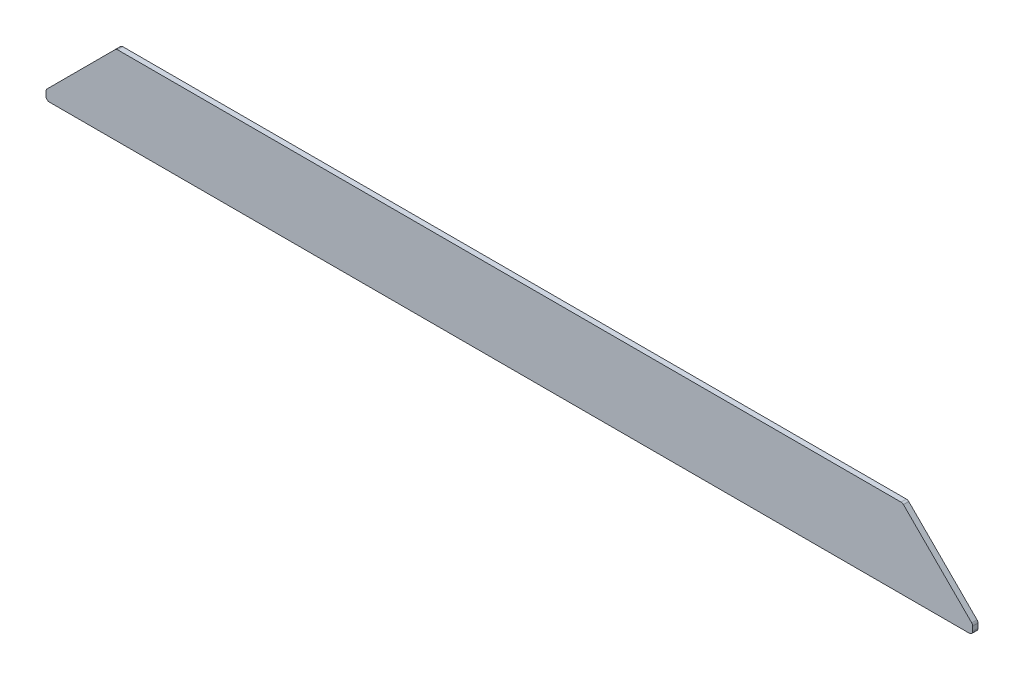
from build123d import *

# Parameters (mm, degrees)
BOSS_EXTRUDE1_DEPTH = 1.6
FILLET1_R           = 1
BOSS_EXTRUDE2_DEPTH = 1.6


with BuildPart() as part:
    # Sketch1 → Boss-Extrude1 (new body)
    with BuildSketch(Plane.XY):
        with BuildLine():
            Line((21.213203436, 24), (0, 2.786796564))
            Line((0, 2.786796564), (0, 0))
            Line((0, 0), (42, 0))
            Line((42, 0), (42, 11))
            ThreePointArc((42, 11), (43.171572875, 13.828427125), (46, 15))
            Line((46, 15), (234, 15))
            ThreePointArc((234, 15), (236.828427125, 13.828427125), (238, 11))
            Line((238, 11), (238, 0))
            Line((238, 0), (280, 0))
            Line((280, 0), (280, 2.786796564))
            Line((280, 2.786796564), (258.786796564, 24))
            Line((258.786796564, 24), (21.213203436, 24))
        make_face()
    extrude(amount=BOSS_EXTRUDE1_DEPTH)

    # Fillet1
    fillet1_edges = [part.edges().sort_by_distance(p)[0] for p in [
        (258.786796564, 24, 0.8),
        (280, 0, 0.8),
        (280, 2.786796564, 0.8),
        (0, 2.786796564, 0.8),
        (0, 0, 0.8),
        (21.213203436, 24, 0.8),
    ]]
    fillet(fillet1_edges, radius=FILLET1_R)

    # Sketch1<3> → Boss-Extrude2 (add)
    with BuildSketch(Plane.XY):
        with BuildLine():
            Line((42, 11), (42, 0))
            Line((42, 0), (238, 0))
            Line((238, 0), (238, 11))
            ThreePointArc((238, 11), (236.828427125, 13.828427125), (234, 15))
            Line((234, 15), (46, 15))
            ThreePointArc((46, 15), (43.171572875, 13.828427125), (42, 11))
        make_face()
    extrude(amount=BOSS_EXTRUDE2_DEPTH)


solid = part.part
